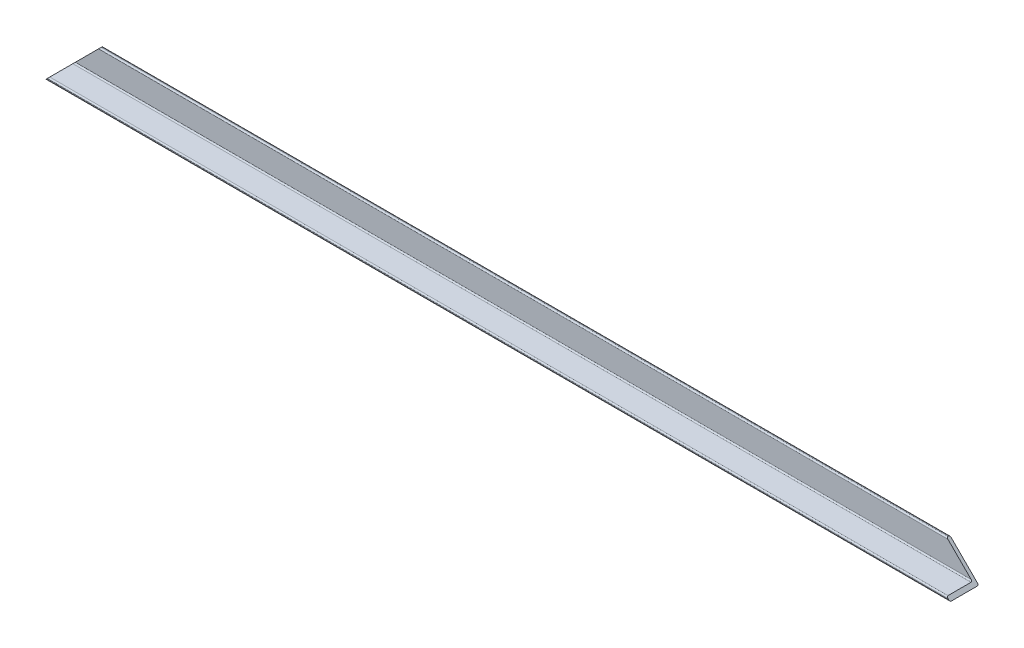
from build123d import *

# Parameters (mm, degrees)
SKETCH1_W               = 720
SKETCH1_H               = 22.5
BOSS_EXTRUDE1_DEPTH     = 2.5
SKETCH2_W               = 720
SKETCH2_H               = 2.5
BOSS_EXTRUDE2_DEPTH     = 20
CUT_EXTRUDE1_DEPTH      = 362.256487831
CUT_EXTRUDE1_DEPTH_BACK = 25
FILLET2_R               = 1


with BuildPart() as part:
    # Sketch1 → Boss-Extrude1 (new body)
    with BuildSketch(Plane(origin=(0, 0, 0), x_dir=(1, 0, 0), z_dir=(0, 1, 0))):
        Rectangle(SKETCH1_W, SKETCH1_H)
    extrude(amount=BOSS_EXTRUDE1_DEPTH)

    # Sketch2 → Boss-Extrude2 (add)
    with BuildSketch(Plane(origin=(0, 2.5, 0), x_dir=(1, 0, 0), z_dir=(0, 1, 0))):
        with Locations((0, 10)):
            Rectangle(SKETCH2_W, SKETCH2_H)
    extrude(amount=BOSS_EXTRUDE2_DEPTH)

    # Sketch3 → Cut-Extrude1 (cut, two sides: drawn at the far end of the back side and taken through both)
    with BuildSketch(Plane.XY.offset(-8.75).offset(-CUT_EXTRUDE1_DEPTH_BACK)):
        Polygon((-360, 22.5), (-360, -7.5), (-330, 22.5), align=None)
        Polygon((360, 22.5), (360, -7.5), (330, 22.5), align=None)
    extrude(amount=CUT_EXTRUDE1_DEPTH + CUT_EXTRUDE1_DEPTH_BACK, mode=Mode.SUBTRACT)

    # Fillet2
    fillet2_edges = [part.edges().sort_by_distance(p)[0] for p in [
        (0, 22.5, -8.75),
        (0, 2.5, -8.75),
        (0, 0, 11.25),
        (0, 2.5, 11.25),
        (0, 22.5, -11.25),
        (0, 0, -11.25),
    ]]
    fillet(fillet2_edges, radius=FILLET2_R)


solid = part.part
